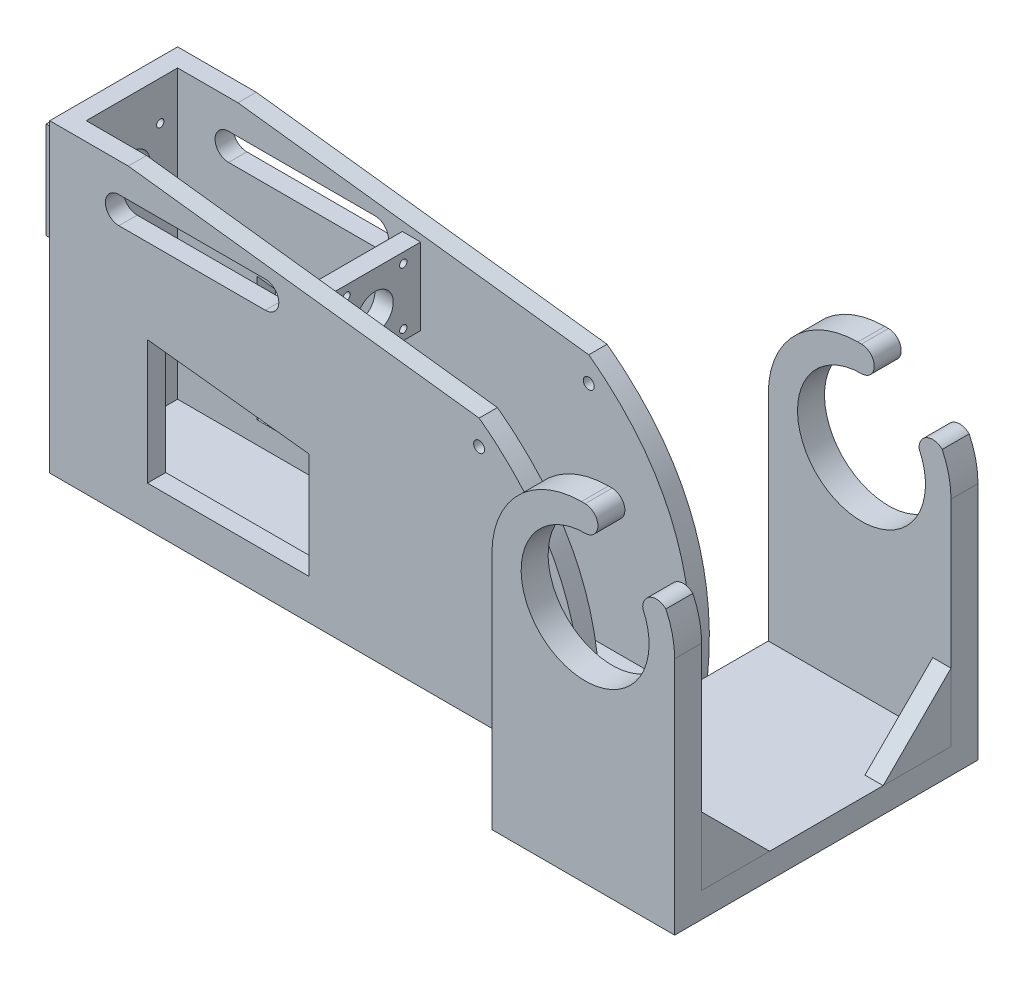
from build123d import *

# Parameters (mm, degrees)
SALIENTE_EXTRUIR1_DEPTH   = 166
CROQUIS2_W                = 136.472436182
CROQUIS2_H                = 332.394220402
CORTAR_EXTRUIR1_DEPTH     = 214.672646822
CROQUIS3_R                = 3
SALIENTE_EXTRUIR2_DEPTH   = 10
CROQUIS4_W                = 290
CROQUIS4_H                = 70
SALIENTE_EXTRUIR4_DEPTH   = 10
CROQUIS5_W                = 70
CROQUIS5_H                = 167
SALIENTE_EXTRUIR5_DEPTH   = 10
SALIENTE_EXTRUIR6_DEPTH   = 10
SALIENTE_EXTRUIR6_2_DEPTH = 10
CROQUIS7_W                = 50
CROQUIS7_H                = 42
CROQUIS7_R                = 10
CROQUIS7_R_2              = 2.028066214
CROQUIS7_R_3              = 1.989058601
CROQUIS7_R_4              = 1.996538367
CROQUIS7_R_5              = 1.989473388
SALIENTE_EXTRUIR7_DEPTH   = 10
CROQUIS8_R                = 1.996538367
CROQUIS8_R_2              = 1.989473388
CROQUIS8_R_3              = 2.028066214
CROQUIS8_R_4              = 1.989058601
CROQUIS8_R_5              = 10
CORTAR_EXTRUIR2_DEPTH     = 425.330060234
CROQUIS9_W                = 54.034718828
CROQUIS9_H                = 52.889277074
CROQUIS9_R                = 2.028066214
CROQUIS9_R_2              = 10
CROQUIS9_R_3              = 1.996538367
CROQUIS9_R_4              = 1.989058601
CROQUIS9_R_5              = 1.989473388
SALIENTE_EXTRUIR8_DEPTH   = 10


with BuildPart() as part:
    # Croquis1 → Saliente-Extruir1 (new body)
    with BuildSketch(Plane.XY):
        with BuildLine():
            Line((-50, -90), (50, -90))
            Line((50, -90), (50, 41))
            ThreePointArc((50, 41), (48.781850172, 51.857936921), (45.187967584, 62.176012863))
            ThreePointArc((45.187967584, 62.176012863), (36.760940571, 63.563110457), (32.562833989, 56.125723473))
            ThreePointArc((32.562833989, 56.125723473), (35.12989298, 48.755669229), (36, 41))
            ThreePointArc((36, 41), (-23.748737342, 16.251262658), (1, 76))
            ThreePointArc((1, 76), (8, 83), (1, 90))
            Line((1, 90), (-1, 90))
            ThreePointArc((-1, 90), (-35.648232278, 75.648232278), (-50, 41))
            Line((-50, 41), (-50, -90))
        make_face()
    extrude(amount=SALIENTE_EXTRUIR1_DEPTH)

    # Croquis2 → Cortar-Extruir1 (cut, through all)
    with BuildSketch(Plane(origin=(50, 0, 0), x_dir=(0, 0, -1), z_dir=(1, 0, 0))):
        with Locations((-83, 90)):
            Rectangle(CROQUIS2_W, CROQUIS2_H)
    extrude(amount=-CORTAR_EXTRUIR1_DEPTH, mode=Mode.SUBTRACT)

    # Croquis3 → Saliente-Extruir2 (add)
    with BuildSketch(Plane(origin=(0, 0, 118), x_dir=(-1, 0, 0), z_dir=(0, 0, -1))):
        with BuildLine():
            Line((340, 77), (297, 77))
            Line((297, 77), (105, 53.549266443))
            add(Edge.make_bspline(
                [(50, -76.197110201), (41.565556501, 6.583471604), (105, 53.549266443)],
                knots=[0, 0, 0, 1, 1, 1], degree=2))
            Line((50, -76.197110201), (50, -90))
            Line((50, -90), (297, -90))
            Line((297, -90), (340, -90))
            Line((340, -90), (340, 35))
            Line((340, 35), (340, 77))
        make_face()
        Polygon((198, -68), (198, -10), (286.5, 0), (286.5, -10), (286.5, -68), align=None, mode=Mode.SUBTRACT)
        with Locations((105, 40)):
            Circle(CROQUIS3_R, mode=Mode.SUBTRACT)
        with BuildLine():
            ThreePointArc((222, 46.169624348), (214.620357905, 53.549266443), (222, 60.928908538))
            Line((222, 60.928908538), (302.121828461, 60.928908538))
            ThreePointArc((302.121828461, 60.928908538), (309.501470556, 53.549266443), (302.121828461, 46.169624348))
            Line((302.121828461, 46.169624348), (222, 46.169624348))
        make_face(mode=Mode.SUBTRACT)
    saliente_extruir2 = extrude(amount=SALIENTE_EXTRUIR2_DEPTH)

    # Simetría1: Saliente-Extruir2 across plane
    add(saliente_extruir2.mirror(Plane(origin=(0, 0, 83), x_dir=(1, 0, 0), z_dir=(0, 0, -1))))

    # Croquis4 → Saliente-Extruir4 (add)
    with BuildSketch(Plane.XZ.offset(90)):
        with Locations((-195, 83)):
            Rectangle(CROQUIS4_W, CROQUIS4_H)
    extrude(amount=-SALIENTE_EXTRUIR4_DEPTH)

    # Croquis5 → Saliente-Extruir5 (add)
    with BuildSketch(Plane.ZY.offset(340)):
        with Locations((83, -6.5)):
            Rectangle(CROQUIS5_W, CROQUIS5_H)
    extrude(amount=-SALIENTE_EXTRUIR5_DEPTH)

    # Croquis7 → Saliente-Extruir7 (add)
    with BuildSketch(Plane.ZY.offset(197)):
        with Locations((83, 40)):
            Rectangle(CROQUIS7_W, CROQUIS7_H)
        with Locations((83, 40)):
            Circle(CROQUIS7_R, mode=Mode.SUBTRACT)
        with Locations((67.5, 55.5)):
            Circle(CROQUIS7_R_2, mode=Mode.SUBTRACT)
        with Locations((98.5, 55.5)):
            Circle(CROQUIS7_R_3, mode=Mode.SUBTRACT)
        with Locations((98.5, 24.5)):
            Circle(CROQUIS7_R_4, mode=Mode.SUBTRACT)
        with Locations((67.5, 24.5)):
            Circle(CROQUIS7_R_5, mode=Mode.SUBTRACT)
    extrude(amount=SALIENTE_EXTRUIR7_DEPTH)

    # Croquis8 → Cortar-Extruir2 (cut, through all)
    with BuildSketch(Plane(origin=(-330, 0, 0), x_dir=(0, 0, -1), z_dir=(1, 0, 0))):
        with Locations(Location((-98.5, 24.5, 0), (0, 0, 180))):
            Circle(CROQUIS8_R)
        with Locations(Location((-67.5, 24.5, 0), (0, 0, 180))):
            Circle(CROQUIS8_R_2)
        with Locations(Location((-67.5, 55.5, 0), (0, 0, 180))):
            Circle(CROQUIS8_R_3)
        with Locations(Location((-98.5, 55.5, 0), (0, 0, 180))):
            Circle(CROQUIS8_R_4)
        with Locations(Location((-83, 40, 0), (0, 0, 180))):
            Circle(CROQUIS8_R_5)
    extrude(amount=-CORTAR_EXTRUIR2_DEPTH, mode=Mode.SUBTRACT)

    # Croquis9 → Saliente-Extruir8 (add)
    with BuildSketch(Plane.ZY.offset(340)):
        with Locations((83, 40)):
            Rectangle(CROQUIS9_W, CROQUIS9_H)
        with Locations((67.5, 55.5)):
            Circle(CROQUIS9_R, mode=Mode.SUBTRACT)
        with Locations((83, 40)):
            Circle(CROQUIS9_R_2, mode=Mode.SUBTRACT)
        with Locations((98.5, 24.5)):
            Circle(CROQUIS9_R_3, mode=Mode.SUBTRACT)
        with Locations((98.5, 55.5)):
            Circle(CROQUIS9_R_4, mode=Mode.SUBTRACT)
        with Locations((67.5, 24.5)):
            Circle(CROQUIS9_R_5, mode=Mode.SUBTRACT)
    extrude(amount=SALIENTE_EXTRUIR8_DEPTH)


with BuildPart() as body_2:
    # Croquis6 → Saliente-Extruir6 (new body)
    with BuildSketch(Plane(origin=(50, 0, 0), x_dir=(0, 0, -1), z_dir=(1, 0, 0))):
        Polygon((-151.236218091, -76.197110201), (-114.016811226, -76.197110201), (-151.236218091, -38.977703336), align=None)
    extrude(amount=-SALIENTE_EXTRUIR6_DEPTH)


with BuildPart() as body_3:
    # Croquis6 → Saliente-Extruir6 2 (new body)
    with BuildSketch(Plane(origin=(50, 0, 0), x_dir=(0, 0, -1), z_dir=(1, 0, 0))):
        Polygon((-14.763781909, -76.197110201), (-51.883567475, -76.197110201), (-14.763781909, -39.077324636), align=None)
    extrude(amount=-SALIENTE_EXTRUIR6_2_DEPTH)


solid = Compound([part.part, body_2.part, body_3.part])
